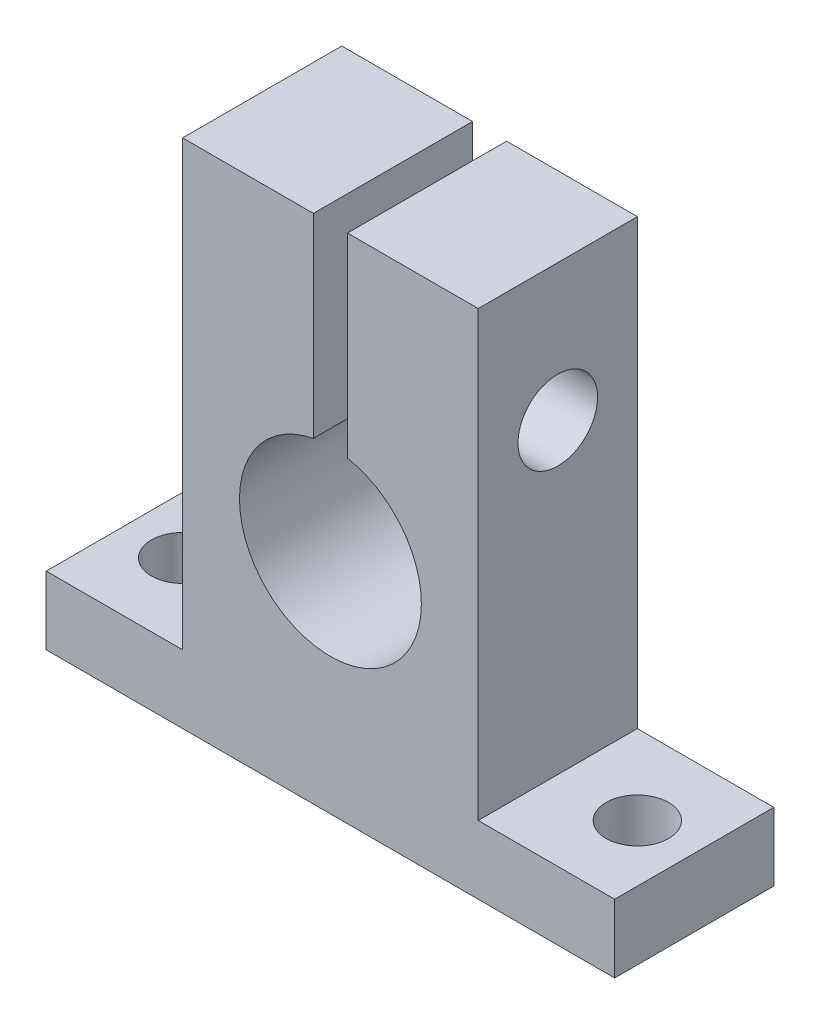
from build123d import *

# Parameters (mm, degrees)
EXTRUDE_1_DEPTH     = 14
CUT_EXTRUDE_START   = -26
SKETCH_2_R          = 3.5
CUT_EXTRUDE_1_DEPTH = 26
SKETCH_3_R          = 2.75
CUT_EXTRUDE_2_DEPTH = 14


with BuildPart() as part:
    # 草图1 → 凸台-拉伸1 (new body)
    with BuildSketch(Plane.XY):
        with BuildLine():
            Line((4.326086957, 24.059506973), (-7.173913043, 24.059506973))
            Line((-7.173913043, 24.059506973), (-7.173913043, -14.940493027))
            Line((-7.173913043, -14.940493027), (-19.173913043, -14.940493027))
            Line((-19.173913043, -14.940493027), (-19.173913043, -20.940493027))
            Line((-19.173913043, -20.940493027), (30.826086957, -20.940493027))
            Line((30.826086957, -20.940493027), (30.826086957, -14.940493027))
            Line((30.826086957, -14.940493027), (18.826086957, -14.940493027))
            Line((18.826086957, -14.940493027), (18.826086957, 24.059506973))
            Line((18.826086957, 24.059506973), (7.326086957, 24.059506973))
            Line((7.326086957, 24.059506973), (7.326086957, 6.917623795))
            ThreePointArc((7.326086957, 6.917623795), (11.990500959, 4.158526486), (13.826086957, -0.940493027))
            ThreePointArc((13.826086957, -0.940493027), (0.727067443, -7.10490703), (4.326086957, 6.917623795))
            Line((4.326086957, 6.917623795), (4.326086957, 24.059506973))
        make_face()
    extrude(amount=EXTRUDE_1_DEPTH)

    # 草图2 → 切除-拉伸1 (cut)
    with BuildSketch(Plane(origin=(18.826086957, 0, 0), x_dir=(0, 0, -1), z_dir=(1, 0, 0)).offset(CUT_EXTRUDE_START)):
        with Locations(Location((-7, 12.059506973, 0), (0, 0, 90))):
            Circle(SKETCH_2_R)
    extrude(amount=CUT_EXTRUDE_1_DEPTH, mode=Mode.SUBTRACT)

    # 草图3 → 切除-拉伸2 (cut)
    with BuildSketch(Plane(origin=(0, -20.940493027, 0), x_dir=(-1, 0, 0), z_dir=(0, -1, 0))):
        with Locations(Location((14.173913043, -7, 0), (0, 0, 180))):
            Circle(SKETCH_3_R)
        with Locations(Location((-25.826086957, -7, 0), (0, 0, 90))):
            Circle(SKETCH_3_R)
    extrude(amount=-CUT_EXTRUDE_2_DEPTH, mode=Mode.SUBTRACT)


solid = part.part
